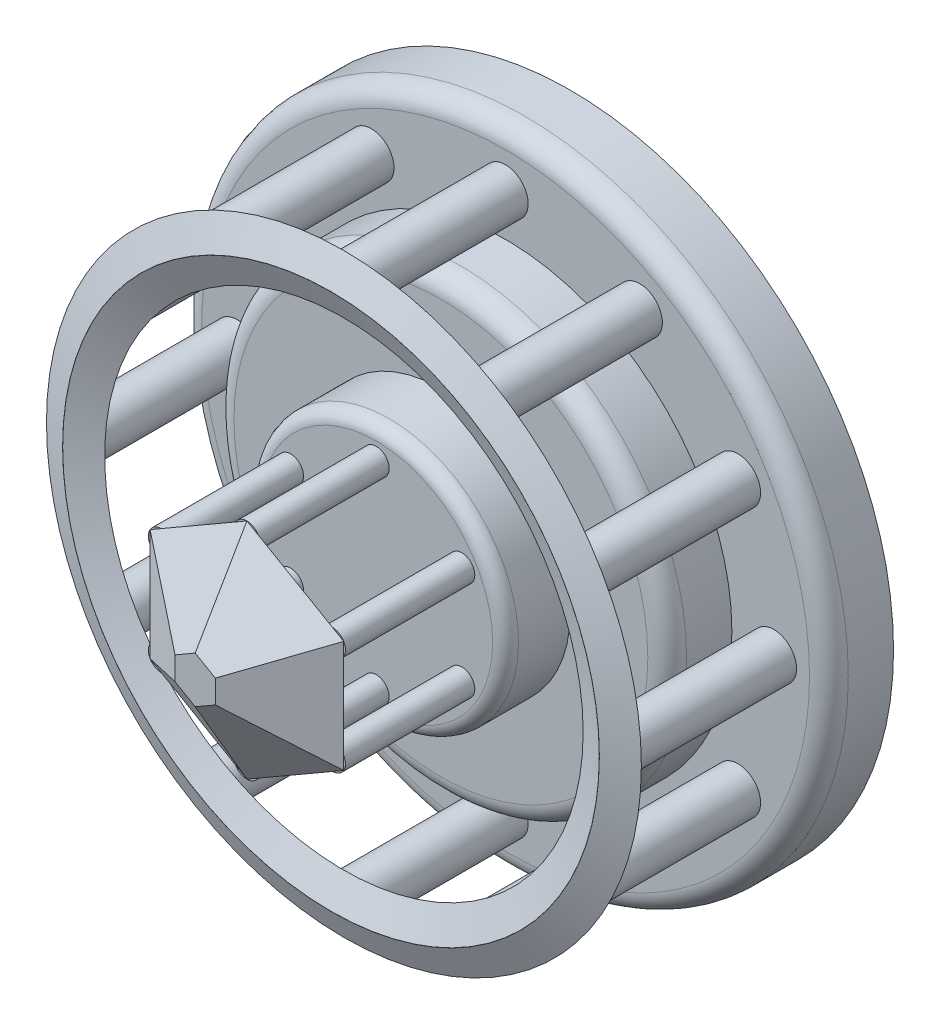
from build123d import *

# Parameters (mm, degrees)
SKICA12_R                = 500
P_IDAT_VYSUNUT_M7_DEPTH  = 100
SKICA13_R                = 350
P_IDAT_VYSUNUT_M8_DEPTH  = 100
SKICA14_R                = 200
P_IDAT_VYSUNUT_M9_DEPTH  = 100
SKICA15_R                = 20
P_IDAT_VYSUNUT_M10_DEPTH = 200
P_IDAT_VYSUNUT_M11_DEPTH = 80
P_IDAT_VYSUNUT_M11_TAPER = 56
ZAOBLIT3_R               = 30
ZAOBLIT4_R               = 30
ZAOBLIT5_R               = 20
SKICA21_R                = 35
P_IDAT_VYSUNUT_M12_DEPTH = 250
SKICA22_R                = 460
SKICA22_R_2              = 370
P_IDAT_VYSUNUT_M13_DEPTH = 20
P_IDAT_VYSUNUT_M13_DRAFT = 66


with BuildPart() as part:
    # Skica12 → Přidat vysunutím7 (new body)
    with BuildSketch(Plane.XY):
        Circle(SKICA12_R)
    extrude(amount=P_IDAT_VYSUNUT_M7_DEPTH)

    # Skica13 → Přidat vysunutím8 (add)
    with BuildSketch(Plane.XY.offset(100)):
        Circle(SKICA13_R)
    extrude(amount=P_IDAT_VYSUNUT_M8_DEPTH)

    # Skica14 → Přidat vysunutím9 (add)
    with BuildSketch(Plane.XY.offset(200)):
        Circle(SKICA14_R)
    extrude(amount=P_IDAT_VYSUNUT_M9_DEPTH)

    # Skica15 → Přidat vysunutím10 (add)
    with BuildSketch(Plane.XY.offset(300)):
        with Locations((0, 152.897535665)):
            Circle(SKICA15_R)
        with Locations((132.413150062, 76.448767833)):
            Circle(SKICA15_R)
        with Locations((132.413150062, -76.448767833)):
            Circle(SKICA15_R)
        with Locations((0, -152.897535665)):
            Circle(SKICA15_R)
        with Locations((-132.413150062, -76.448767833)):
            Circle(SKICA15_R)
        with Locations((-132.413150062, 76.448767833)):
            Circle(SKICA15_R)
    extrude(amount=P_IDAT_VYSUNUT_M10_DEPTH)

    # Skica16 → Přidat vysunutím11 (add)
    with BuildSketch(Plane.XY.offset(500)):
        Polygon((-149.73345205, -86.449124779), (0.000412169, -172.897535661), (149.733864218, -86.448410882), (149.73345205, 86.449124779), (-0.000412169, 172.897535661), (-149.733864218, 86.448410882), align=None)
    extrude(amount=P_IDAT_VYSUNUT_M11_DEPTH, taper=P_IDAT_VYSUNUT_M11_TAPER)

    # Zaoblit3
    zaoblit3_edges = [part.edges().sort_by_distance(p)[0] for p in [
        (-500, 0, 100),
    ]]
    fillet(zaoblit3_edges, radius=ZAOBLIT3_R)

    # Zaoblit4
    zaoblit4_edges = [part.edges().sort_by_distance(p)[0] for p in [
        (-350, 0, 200),
    ]]
    fillet(zaoblit4_edges, radius=ZAOBLIT4_R)

    # Zaoblit5
    zaoblit5_edges = [part.edges().sort_by_distance(p)[0] for p in [
        (-200, 0, 300),
    ]]
    fillet(zaoblit5_edges, radius=ZAOBLIT5_R)

    # Skica21 → Přidat vysunutím12 (add)
    with BuildSketch(Plane.XY.offset(100)):
        with Locations((0, 415)):
            Circle(SKICA21_R)
        with Locations((207.5, 359.400542571)):
            Circle(SKICA21_R)
        with Locations((359.400542571, 207.5)):
            Circle(SKICA21_R)
        with Locations((415, 0)):
            Circle(SKICA21_R)
        with Locations((359.400542571, -207.5)):
            Circle(SKICA21_R)
        with Locations((207.5, -359.400542571)):
            Circle(SKICA21_R)
        with Locations((0, -415)):
            Circle(SKICA21_R)
        with Locations((-207.5, -359.400542571)):
            Circle(SKICA21_R)
        with Locations((-359.400542571, -207.5)):
            Circle(SKICA21_R)
        with Locations((-415, 0)):
            Circle(SKICA21_R)
        with Locations((-359.400542571, 207.5)):
            Circle(SKICA21_R)
        with Locations((-207.5, 359.400542571)):
            Circle(SKICA21_R)
    extrude(amount=P_IDAT_VYSUNUT_M12_DEPTH)


with BuildPart() as p_idat_vysunut_m13_tool:
    # Skica22 → Přidat vysunutím13 (with draft: the straight prism first)
    with BuildSketch(Plane.XY.offset(350)):
        Circle(SKICA22_R)
        Circle(SKICA22_R_2, mode=Mode.SUBTRACT)
    extrude(amount=P_IDAT_VYSUNUT_M13_DEPTH)
    # Přidat vysunutím13: the draft: its side faces are tilted about the plane it starts from
    p_idat_vysunut_m13_sides = [p_idat_vysunut_m13_tool.faces().sort_by_distance(p)[0] for p in [
        (-460, 0, 360),
        (-370, 0, 360),
    ]]
    draft(p_idat_vysunut_m13_sides, Plane.XY.offset(350), P_IDAT_VYSUNUT_M13_DRAFT)


with BuildPart() as part_1:
    add(part.part)

    # Přidat vysunutím13: add p_idat_vysunut_m13_tool
    add(p_idat_vysunut_m13_tool.part)


solid = part_1.part
